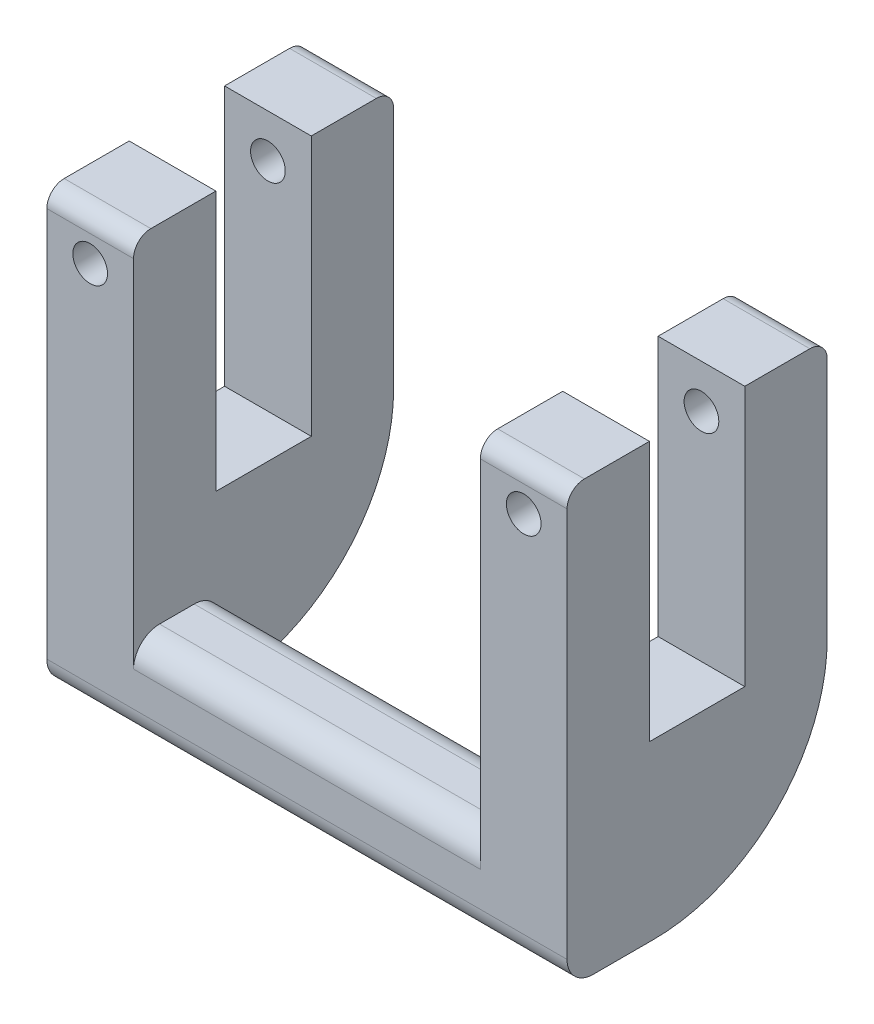
from build123d import *

# Parameters (mm, degrees)
BOSS_EXTRUDE1_DEPTH     = 30
CUT_EXTRUDE1_DEPTH      = 79.102496759
CUT_EXTRUDE1_DEPTH_BACK = 79.102496759
SKETCH2_W               = 11
SKETCH2_H               = 60
SKETCH3_W               = 40
SKETCH3_H               = 10
CUT_EXTRUDE2_DEPTH      = 20
FILLET2_R               = 3
FILLET3_R               = 20
CUT_EXTRUDE3_DEPTH      = 71.710678119
CUT_EXTRUDE3_DEPTH_BACK = 71.710678119
SKETCH4_R               = 2
CUT_EXTRUDE4_DEPTH      = 71.710678119
CUT_EXTRUDE4_DEPTH_BACK = 71.710678119
SKETCH5_R               = 2
FILLET4_R               = 2


with BuildPart() as part:
    # Sketch1 → Boss-Extrude1 (new body)
    with BuildSketch(Plane.XY):
        Polygon((0, 0), (-40, 0), (-40, 40), (-50, 40), (-50, -10), (10, -10), (10, 40), (0, 40), align=None)
    extrude(amount=BOSS_EXTRUDE1_DEPTH)

    # Sketch2 → Cut-Extrude1 (cut, two sides: drawn at the far end of the back side and taken through both)
    with BuildSketch(Plane(origin=(10, 0, 0), x_dir=(0, 0, -1), z_dir=(1, 0, 0)).offset(-CUT_EXTRUDE1_DEPTH_BACK)):
        with Locations((-15, 40)):
            Rectangle(SKETCH2_W, SKETCH2_H)
    extrude(amount=CUT_EXTRUDE1_DEPTH + CUT_EXTRUDE1_DEPTH_BACK, mode=Mode.SUBTRACT)

    # Sketch3 → Cut-Extrude2 (cut)
    with BuildSketch(Plane(origin=(0, 0, 0), x_dir=(-1, 0, 0), z_dir=(0, 0, -1))):
        with Locations((20, -5)):
            Rectangle(SKETCH3_W, SKETCH3_H)
    extrude(amount=-CUT_EXTRUDE2_DEPTH, mode=Mode.SUBTRACT)

    # Fillet2
    fillet2_edges = [part.edges().sort_by_distance(p)[0] for p in [
        (-20, -10, 30),
        (-20, 0, 20),
        (-20, -10, 20),
        (-20, 0, 30),
    ]]
    fillet(fillet2_edges, radius=FILLET2_R)

    # Fillet3
    fillet3_edges = [part.edges().sort_by_distance(p)[0] for p in [
        (5, -10, 0),
        (-45, -10, 0),
    ]]
    fillet(fillet3_edges, radius=FILLET3_R)

    # Sketch4 → Cut-Extrude3 (cut, two sides: drawn at the far end of the back side and taken through both)
    with BuildSketch(Plane(origin=(0, 0, 0), x_dir=(-1, 0, 0), z_dir=(0, 0, -1)).offset(-CUT_EXTRUDE3_DEPTH_BACK)):
        with Locations((-5, 35)):
            Circle(SKETCH4_R)
    extrude(amount=CUT_EXTRUDE3_DEPTH + CUT_EXTRUDE3_DEPTH_BACK, mode=Mode.SUBTRACT)

    # Sketch5 → Cut-Extrude4 (cut, two sides: drawn at the far end of the back side and taken through both)
    with BuildSketch(Plane(origin=(0, 0, 0), x_dir=(-1, 0, 0), z_dir=(0, 0, -1)).offset(-CUT_EXTRUDE4_DEPTH_BACK)):
        with Locations((45, 35)):
            Circle(SKETCH5_R)
    extrude(amount=CUT_EXTRUDE4_DEPTH + CUT_EXTRUDE4_DEPTH_BACK, mode=Mode.SUBTRACT)

    # Fillet4
    fillet4_edges = [part.edges().sort_by_distance(p)[0] for p in [
        (-45, 40, 30),
        (5, 40, 30),
        (5, 40, 0),
        (-45, 40, 0),
    ]]
    fillet(fillet4_edges, radius=FILLET4_R)


solid = part.part
